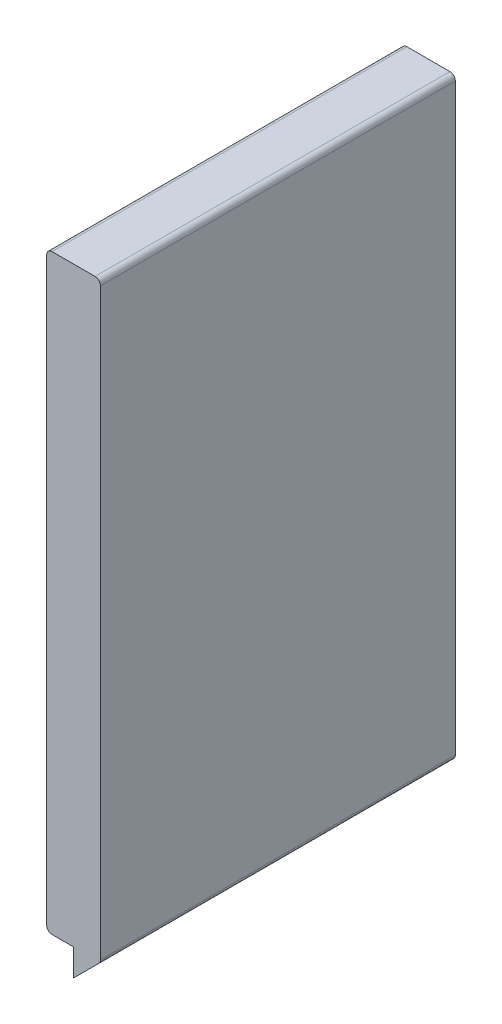
from build123d import *

# Parameters (mm, degrees)
BOSS_EXTRUDE1_DEPTH = 33
FILLET1_R           = 1


with BuildPart() as part:
    # Sketch1 → Boss-Extrude1 (new, symmetric)
    with BuildSketch(Plane.XY):
        Polygon((5, -55), (5, -60), (10, -55), (10, 55), (0, 55), (0, -55), align=None)
    extrude(amount=BOSS_EXTRUDE1_DEPTH, both=True)

    # Fillet1
    fillet1_edges = [part.edges().sort_by_distance(p)[0] for p in [
        (10, -55, 0),
        (0, -55, 0),
        (0, 55, 0),
        (10, 55, 0),
    ]]
    fillet(fillet1_edges, radius=FILLET1_R)


solid = part.part
